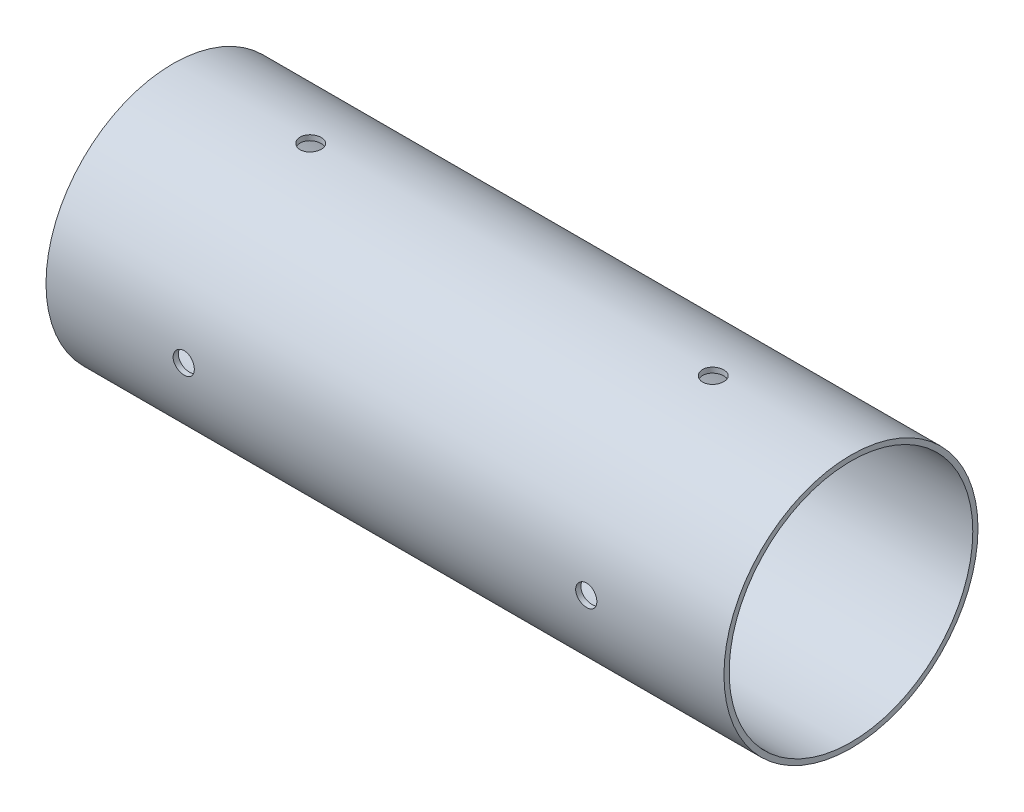
from build123d import *

# Parameters (mm, degrees)
SKETCH1_R           = 38.0746
SKETCH1_R_2         = 36.5125
BOSS_EXTRUDE1_DEPTH = 203.2
SKETCH2_R           = 3.175
CUT_EXTRUDE1_DEPTH  = 211.213202084
CIRPATTERN1_COUNT   = 4
SKETCH3_R           = 3.175
CUT_EXTRUDE2_DEPTH  = 211.213202217
CIRPATTERN2_COUNT   = 4


with BuildPart() as part:
    # Sketch1 → Boss-Extrude1 (new body)
    with BuildSketch(Plane.YZ):
        with Locations(Location((0, 0, 0), (0, 0, 270))):
            Circle(SKETCH1_R)
        with Locations(Location((0, 0, 0), (0, 0, 270))):
            Circle(SKETCH1_R_2, mode=Mode.SUBTRACT)
    extrude(amount=BOSS_EXTRUDE1_DEPTH)

    # Sketch2 → Cut-Extrude1 (cut, through all)
    with BuildSketch(Plane(origin=(0, 0, 0), x_dir=(-1, 0, 0), z_dir=(0, 1, 0))):
        with Locations(Location((-41.275, 0, 0), (0, 0, 270))):
            Circle(SKETCH2_R)
    cut_extrude1 = extrude(amount=CUT_EXTRUDE1_DEPTH, mode=Mode.SUBTRACT)

    # CirPattern1: Cut-Extrude1 ×4 about axis
    cirpattern1_axis = Axis((203.2, 0, 0), (-1, 0, 0))
    for i in range(1, CIRPATTERN1_COUNT):
        add(cut_extrude1.rotate(cirpattern1_axis, i * 360 / CIRPATTERN1_COUNT), mode=Mode.SUBTRACT)

    # Sketch3 → Cut-Extrude2 (cut, through all)
    with BuildSketch(Plane(origin=(0, 0, 0), x_dir=(-1, 0, 0), z_dir=(0, 1, 0))):
        with Locations(Location((-161.925, 0, 0), (0, 0, 270))):
            Circle(SKETCH3_R)
    cut_extrude2 = extrude(amount=CUT_EXTRUDE2_DEPTH, mode=Mode.SUBTRACT)

    # CirPattern2: Cut-Extrude2 ×4 about axis
    cirpattern2_axis = Axis((203.2, 0, 0), (-1, 0, 0))
    for i in range(1, CIRPATTERN2_COUNT):
        add(cut_extrude2.rotate(cirpattern2_axis, i * 360 / CIRPATTERN2_COUNT), mode=Mode.SUBTRACT)


solid = part.part
